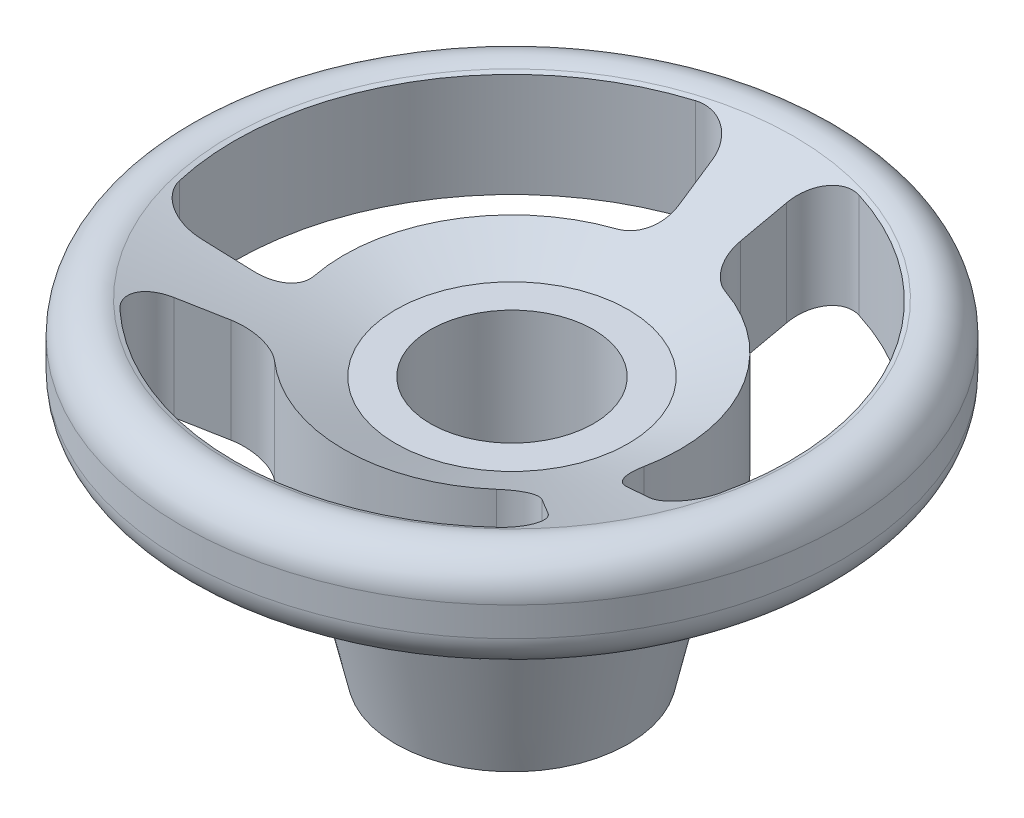
from build123d import *

# Parameters (mm, degrees)
ENL_V_MAT_EXTRU_1_DEPTH      = 34.496268449
ENL_V_MAT_EXTRU_1_DEPTH_BACK = 34.496268449
CONG_1_R                     = 2
CONG_2_R                     = 2
ENL_V_START                  = -5
ESQUISSE4_R                  = 6.7
ENL_V_MAT_EXTRU_2_DEPTH      = 5


with BuildPart() as part:
    # Esquisse2 → Révolution1 (revolve)
    with BuildSketch(Plane.XY, mode=Mode.PRIVATE) as r_volution1_sk:
        Polygon((4.7, 0), (4.7, 20), (6.7, 20), (6.7, 15), (19, 20), (19, 14), (9, 9.93495935), (6.7, 0), align=None)
    revolve(r_volution1_sk.sketch.rotate(Axis((0, 0, 0), (0, 1, 0)), 90), axis=Axis((0, 0, 0), (0, 1, 0)))

    # Esquisse3 → Enlèv. mat.-Extru.1 (cut, two sides: drawn at the far end of the back side and taken through both)
    with BuildSketch(Plane(origin=(0, 20, 0), x_dir=(1, 0, 0), z_dir=(0, 1, 0)).offset(-ENL_V_MAT_EXTRU_1_DEPTH_BACK)):
        with BuildLine():
            Line((-1.5, 9.583318841), (-2.474226804, 15.807536232))
            ThreePointArc((-2.474226804, 15.807536232), (-13.856406461, 8), (-14.92684135, -5.761024849))
            Line((-14.92684135, -5.761024849), (-9.049397568, -3.492621315))
            ThreePointArc((-9.049397568, -3.492621315), (-8.400446417, 4.85), (-1.5, 9.583318841))
        make_face()
        with BuildLine():
            Line((9.049397568, -3.492621315), (14.92684135, -5.761024849))
            ThreePointArc((14.92684135, -5.761024849), (13.856406461, 8), (2.474226804, 15.807536232))
            Line((2.474226804, 15.807536232), (1.5, 9.583318841))
            ThreePointArc((1.5, 9.583318841), (8.400446417, 4.85), (9.049397568, -3.492621315))
        make_face()
        with BuildLine():
            Line((-7.549397568, -6.090697526), (-12.452614546, -10.046511383))
            ThreePointArc((-12.452614546, -10.046511383), (0, -16), (12.452614546, -10.046511383))
            Line((12.452614546, -10.046511383), (7.549397568, -6.090697526))
            ThreePointArc((7.549397568, -6.090697526), (0, -9.7), (-7.549397568, -6.090697526))
        make_face()
    extrude(amount=ENL_V_MAT_EXTRU_1_DEPTH + ENL_V_MAT_EXTRU_1_DEPTH_BACK, mode=Mode.SUBTRACT)

    # Congé1
    cong_1_edges = [part.edges().sort_by_distance(p)[0] for p in [
        (0, 14, 19),
        (0, 20, 19),
    ]]
    fillet(cong_1_edges, radius=CONG_1_R)

    # Congé2
    cong_2_edges = [part.edges().sort_by_distance(p)[0] for p in [
        (-14.92684135, 15.780487805, 5.761024849),
        (-2.474226804, 15.780487805, -15.807536232),
        (-1.5, 13.219512195, -9.583318841),
        (-9.049397568, 13.219512195, 3.492621315),
        (2.474226804, 15.780487805, -15.807536232),
        (14.92684135, 15.780487805, 5.761024849),
        (9.049397568, 13.219512195, 3.492621315),
        (1.5, 13.219512195, -9.583318841),
        (12.452614546, 15.780487805, 10.046511383),
        (-12.452614546, 15.780487805, 10.046511383),
        (-7.549397568, 13.219512195, 6.090697526),
        (7.549397568, 13.219512195, 6.090697526),
    ]]
    fillet(cong_2_edges, radius=CONG_2_R)

    # Esquisse4 → Enlèv. mat.-Extru.2 (cut)
    with BuildSketch(Plane(origin=(0, 20, 0), x_dir=(1, 0, 0), z_dir=(0, 1, 0)).offset(ENL_V_START)):
        Circle(ESQUISSE4_R)
    extrude(amount=ENL_V_MAT_EXTRU_2_DEPTH, mode=Mode.SUBTRACT)


solid = part.part
